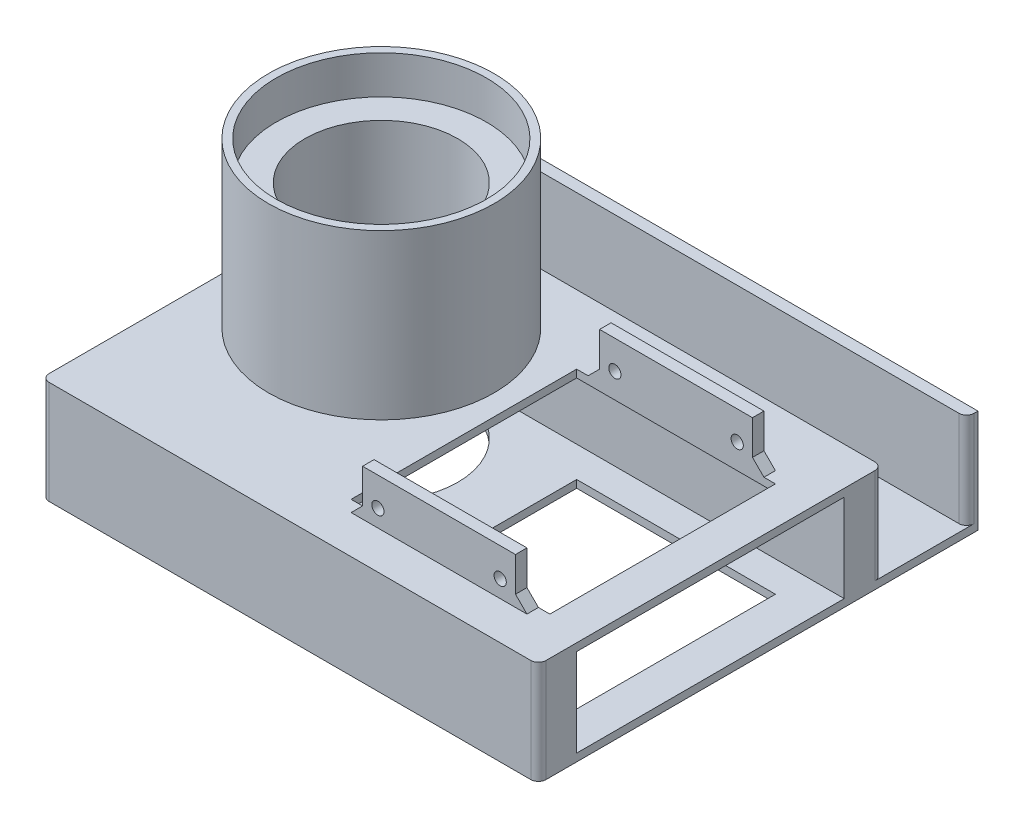
from build123d import *

# Parameters (mm, degrees)
SKETCH1_R             = 29.5
SKETCH1_R_2           = 20
BOSS_EXTRUDE1_DEPTH   = 42.88
CUT_EXTRUDE1_START    = -10
SKETCH2_R             = 27.5
SKETCH2_R_2           = 20
CUT_EXTRUDE1_DEPTH    = 10
SKETCH4_W             = 40
SKETCH4_H             = 3
BOSS_EXTRUDE2_DEPTH   = 12
BOSS_EXTRUDE2_2_DEPTH = 12
CUT_EXTRUDE2_START    = -65
SKETCH5_R             = 1.6
CUT_EXTRUDE2_DEPTH    = 65
BOSS_EXTRUDE3_START   = -2
SKETCH6_W             = 130
SKETCH6_H             = 90
SKETCH6_R             = 20
SKETCH6_W_2           = 52
SKETCH6_H_2           = 59
BOSS_EXTRUDE3_DEPTH   = 2
SKETCH8_W             = 130
SKETCH8_H             = 10
BOSS_EXTRUDE4_DEPTH   = 23
BOSS_EXTRUDE5_START   = 2
SKETCH9_W             = 130
SKETCH9_H             = 90
SKETCH9_R             = 20
SKETCH9_W_2           = 52
SKETCH9_H_2           = 59
BOSS_EXTRUDE5_DEPTH   = 2
CHAMFER1_SIZE         = 3
BOSS_EXTRUDE6_DEPTH   = 130
FILLET1_R             = 2


with BuildPart() as part:
    # Sketch1 → Boss-Extrude1 (new body)
    with BuildSketch(Plane(origin=(0, 0, 0), x_dir=(1, 0, 0), z_dir=(0, 1, 0))):
        with Locations(Location((0, 0, 0), (0, 0, 270))):
            Circle(SKETCH1_R)
        with Locations(Location((0, 0, 0), (0, 0, 270))):
            Circle(SKETCH1_R_2, mode=Mode.SUBTRACT)
    extrude(amount=BOSS_EXTRUDE1_DEPTH)

    # Sketch2 → Cut-Extrude1 (cut)
    with BuildSketch(Plane(origin=(0, 42.88, 0), x_dir=(1, 0, 0), z_dir=(0, 1, 0)).offset(CUT_EXTRUDE1_START)):
        with Locations(Location((0, 0, 0), (0, 0, 270))):
            Circle(SKETCH2_R)
        with Locations(Location((0, 0, 0), (0, 0, 270))):
            Circle(SKETCH2_R_2, mode=Mode.SUBTRACT)
    extrude(amount=CUT_EXTRUDE1_DEPTH, mode=Mode.SUBTRACT)



with BuildPart() as body_2:
    # Sketch4 → Boss-Extrude2 (new body)
    with BuildSketch(Plane(origin=(0, 0, 0), x_dir=(1, 0, 0), z_dir=(0, 1, 0))):
        with Locations((60.9, 17.7)):
            Rectangle(SKETCH4_W, SKETCH4_H)
    extrude(amount=BOSS_EXTRUDE2_DEPTH)


with BuildPart() as body_3:
    # Sketch4 → Boss-Extrude2 2 (new body)
    with BuildSketch(Plane(origin=(0, 0, 0), x_dir=(1, 0, 0), z_dir=(0, 1, 0))):
        with Locations((60.9, -44.3)):
            Rectangle(SKETCH4_W, SKETCH4_H)
    extrude(amount=BOSS_EXTRUDE2_2_DEPTH)


with BuildPart() as cut_extrude2_tool:
    # Sketch5 → Cut-Extrude2 (new body)
    with BuildSketch(Plane.XY.offset(45.8).offset(CUT_EXTRUDE2_START)):
        with Locations((44.9, 4.5)):
            Circle(SKETCH5_R)
        with Locations((76.9, 4.5)):
            Circle(SKETCH5_R)
    extrude(amount=CUT_EXTRUDE2_DEPTH)


with BuildPart() as body_2_1:
    add(body_2.part)

    # Cut-Extrude2: cut by cut_extrude2_tool
    add(cut_extrude2_tool.part, mode=Mode.SUBTRACT)


with BuildPart() as body_3_1:
    add(body_3.part)

    # Cut-Extrude2: cut by cut_extrude2_tool
    add(cut_extrude2_tool.part, mode=Mode.SUBTRACT)


with BuildPart() as part_1:
    add(part.part)

    add(body_2_1.part)  # Boss-Extrude3 merges body 2

    add(body_3_1.part)  # Boss-Extrude3 merges body 3
    # Sketch6 → Boss-Extrude3 (add)
    with BuildSketch(Plane(origin=(0, 0, 0), x_dir=(1, 0, 0), z_dir=(0, 1, 0)).offset(BOSS_EXTRUDE3_START)):
        with Locations((31.9, -10.8)):
            Rectangle(SKETCH6_W, SKETCH6_H)
        with Locations(Location((0, 0, 0), (0, 0, 270))):
            Circle(SKETCH6_R, mode=Mode.SUBTRACT)
        with Locations((60.9, -13.3)):
            Rectangle(SKETCH6_W_2, SKETCH6_H_2, mode=Mode.SUBTRACT)
    extrude(amount=BOSS_EXTRUDE3_DEPTH)

    # Sketch8 → Boss-Extrude4 (add)
    with BuildSketch(Plane.XZ.offset(2)):
        with Locations((31.9, 50.8)):
            Rectangle(SKETCH8_W, SKETCH8_H)
        with Locations((31.9, -29.2)):
            Rectangle(SKETCH8_W, SKETCH8_H)
    extrude(amount=BOSS_EXTRUDE4_DEPTH)

    # Sketch9 → Boss-Extrude5 (add)
    with BuildSketch(Plane.XZ.offset(25).offset(BOSS_EXTRUDE5_START)):
        with Locations((31.9, 10.8)):
            Rectangle(SKETCH9_W, SKETCH9_H)
        with Locations(Location((0, 0, 0), (0, 0, 90))):
            Circle(SKETCH9_R, mode=Mode.SUBTRACT)
        with Locations((60.9, 13.3)):
            Rectangle(SKETCH9_W_2, SKETCH9_H_2, mode=Mode.SUBTRACT)
    extrude(amount=-BOSS_EXTRUDE5_DEPTH)

    # Chamfer1
    chamfer1_edges = [part_1.edges().sort_by_distance(p)[0] for p in [
        (40.9, 0, -17.7),
        (80.9, 0, -17.7),
        (40.9, 0, 44.3),
        (80.9, 0, 44.3),
    ]]
    chamfer(chamfer1_edges, length=CHAMFER1_SIZE)

    # Sketch11 → Boss-Extrude6 (add)
    with BuildSketch(Plane(origin=(96.9, 0, 0), x_dir=(0, 0, -1), z_dir=(1, 0, 0))):
        Polygon((34.2, -27), (34.2, -25), (56.2, -25), (56.2, 0), (59.2, 0), (59.2, -27), align=None)
    extrude(amount=-BOSS_EXTRUDE6_DEPTH)

    # Fillet1
    fillet1_edges = [part_1.edges().sort_by_distance(p)[0] for p in [
        (96.9, -12.5, -34.2),
        (-33.1, -12.5, -34.2),
        (96.9, -12.5, -56.2),
        (-33.1, -13.5, 55.8),
        (-33.1, -12.5, -56.2),
        (96.9, -13.5, 55.8),
    ]]
    fillet(fillet1_edges, radius=FILLET1_R)


solid = part_1.part
